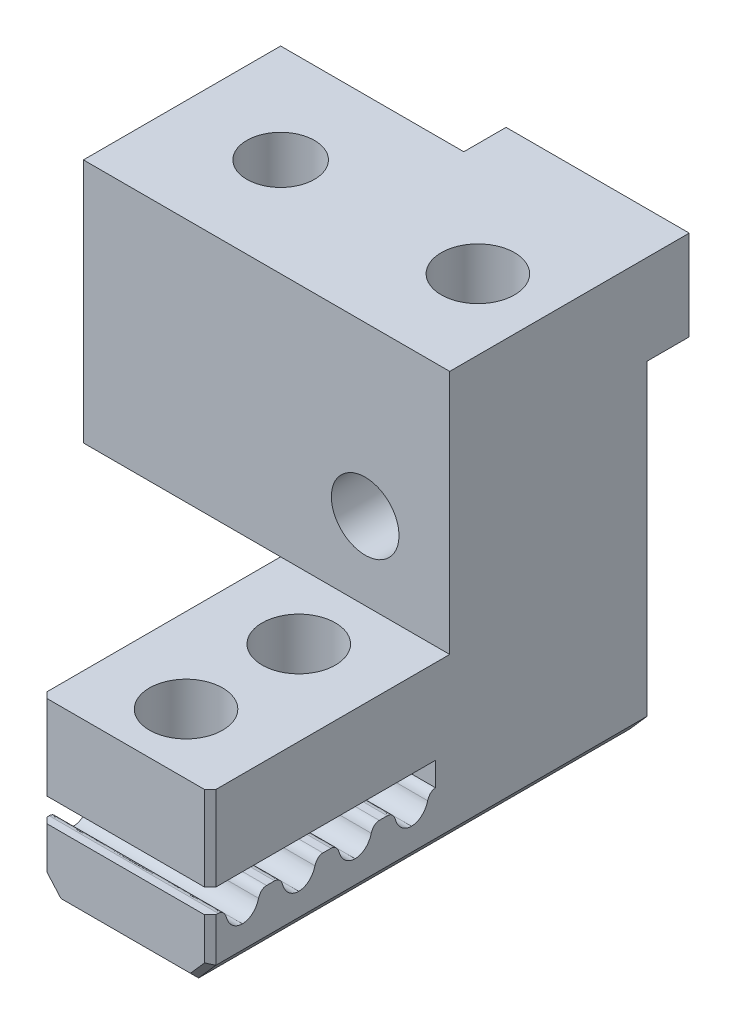
from build123d import *

# Parameters (mm, degrees)
BOSS_EXTRUDE1_DEPTH     = 13
SKETCH6_W               = 6
SKETCH6_H               = 5
BOSS_EXTRUDE4_DEPTH     = 5.6
SKETCH16_W              = 6
SKETCH16_H              = 8
BOSS_EXTRUDE5_DEPTH     = 0.1
CUT_EXTRUDE6_DEPTH      = 4
CUT_EXTRUDE6_DEPTH_BACK = 3.6
SKETCH15_R              = 1.3
CUT_EXTRUDE7_DEPTH      = 8.7202
CUT_EXTRUDE8_START      = -0.2202
SKETCH19_W              = 6
SKETCH19_H              = 8
SKETCH19_R              = 1.3
CUT_EXTRUDE8_DEPTH      = 0.2202
SKETCH12_R              = 1.2
CUT_EXTRUDE5_DEPTH      = 6
CHAMFER1_SIZE           = 0.2
SKETCH21_R              = 1.2
BOSS_EXTRUDE6_DEPTH     = 2.5
SKETCH24_W              = 6
SKETCH24_H              = 5.5
CUT_EXTRUDE10_DEPTH     = 8.5
SKETCH25_W              = 6
SKETCH25_H              = 7
BOSS_EXTRUDE8_DEPTH     = 12.9
SKETCH26_W              = 6
SKETCH26_H              = 7.39
BOSS_EXTRUDE9_DEPTH     = 3
SKETCH30_R              = 1.2
CUT_EXTRUDE13_DEPTH     = 8
SKETCH31_W              = 7
SKETCH31_H              = 9
BOSS_EXTRUDE11_DEPTH    = 1
SKETCH32_W              = 7
SKETCH32_H              = 9
BOSS_EXTRUDE12_DEPTH    = 1
BOSS_EXTRUDE13_DEPTH    = 1
BOSS_EXTRUDE14_DEPTH    = 1
SKETCH35_W              = 10
SKETCH35_H              = 4.2
CUT_EXTRUDE14_DEPTH     = 10
BOSS_EXTRUDE15_DEPTH    = 6
SKETCH38_R              = 1.3
CUT_EXTRUDE15_DEPTH     = 4
SKETCH39_R              = 1.2
CUT_EXTRUDE16_DEPTH     = 10
SKETCH40_W              = 14
SKETCH40_H              = 1.5
CUT_EXTRUDE17_DEPTH     = 10
SKETCH41_W              = 6.5
SKETCH41_H              = 3.19
CUT_EXTRUDE18_DEPTH     = 1.5
CROQUIS3_W              = 8.5
CROQUIS3_H              = 8.726674232
CORTAR_EXTRUIR3_DEPTH   = 1


with BuildPart() as part:
    # Sketch1 → Boss-Extrude1 (new body)
    with BuildSketch(Plane.XY):
        Polygon((3, 3.05), (3, -2.253801214), (2.388188946, -2.95), (-2.388188946, -2.95), (-3, -2.253801214), (-3, 3.05), align=None)
    extrude(amount=BOSS_EXTRUDE1_DEPTH)

    # Sketch6 → Boss-Extrude4 (add)
    with BuildSketch(Plane(origin=(0, 3.05, 0), x_dir=(1, 0, 0), z_dir=(0, 1, 0))):
        with Locations((0, -2.5)):
            Rectangle(SKETCH6_W, SKETCH6_H)
    extrude(amount=BOSS_EXTRUDE4_DEPTH)

    # Sketch16 → Boss-Extrude5 (add)
    with BuildSketch(Plane(origin=(0, 3.05, 0), x_dir=(1, 0, 0), z_dir=(0, 1, 0))):
        with Locations((0, -9)):
            Rectangle(SKETCH16_W, SKETCH16_H)
    extrude(amount=BOSS_EXTRUDE5_DEPTH)

    # Sketch18 → Cut-Extrude6 (cut, two sides: drawn at the far end of the back side and taken through both)
    with BuildSketch(Plane(origin=(0, 0, 0), x_dir=(0, 0, -1), z_dir=(1, 0, 0)).offset(-CUT_EXTRUDE6_DEPTH_BACK)):
        with BuildLine():
            Line((-8.8572, -0.0702), (-12.8572, -0.0702))
            Line((-12.8572, -0.0702), (-13, -0.0702))
            Line((-13, -0.0702), (-13, -0.7))
            Line((-13, -0.7), (-12.8572, -0.7))
            Line((-12.8572, -0.7), (-12.7144, -0.7))
            add(Edge.make_bspline(
                [(-12.7144, -0.7), (-12.5198, -0.7), (-12.43, -0.9509)],
                knots=[0.103448276, 0.103448276, 0.103448276, 0.137931034, 0.137931034, 0.137931034], degree=2))
            add(Edge.make_bspline(
                [(-12.43, -0.9509), (-12.3594, -1.2388), (-12.13, -1.45), (-11.8572, -1.45)],
                knots=[0.137931034, 0.137931034, 0.137931034, 0.137931034, 0.172413793, 0.172413793, 0.172413793, 0.172413793], degree=3))
            add(Edge.make_bspline(
                [(-11.8572, -1.45), (-11.5844, -1.45), (-11.355, -1.2388), (-11.2844, -0.9509)],
                knots=[0.172413793, 0.172413793, 0.172413793, 0.172413793, 0.206896552, 0.206896552, 0.206896552, 0.206896552], degree=3))
            add(Edge.make_bspline(
                [(-11.2844, -0.9509), (-11.1946, -0.7), (-11, -0.7)],
                knots=[0.206896552, 0.206896552, 0.206896552, 0.24137931, 0.24137931, 0.24137931], degree=2))
            Line((-11, -0.7), (-10.8572, -0.7))
            Line((-10.8572, -0.7), (-10.7144, -0.7))
            add(Edge.make_bspline(
                [(-10.7144, -0.7), (-10.5198, -0.7), (-10.43, -0.9509)],
                knots=[0.310344828, 0.310344828, 0.310344828, 0.344827586, 0.344827586, 0.344827586], degree=2))
            add(Edge.make_bspline(
                [(-10.43, -0.9509), (-10.3594, -1.2388), (-10.13, -1.45), (-9.8572, -1.45)],
                knots=[0.344827586, 0.344827586, 0.344827586, 0.344827586, 0.379310345, 0.379310345, 0.379310345, 0.379310345], degree=3))
            add(Edge.make_bspline(
                [(-9.8572, -1.45), (-9.5844, -1.45), (-9.355, -1.2388), (-9.2844, -0.9509)],
                knots=[0.379310345, 0.379310345, 0.379310345, 0.379310345, 0.413793103, 0.413793103, 0.413793103, 0.413793103], degree=3))
            add(Edge.make_bspline(
                [(-9.2844, -0.9509), (-9.1946, -0.7), (-9, -0.7)],
                knots=[0.413793103, 0.413793103, 0.413793103, 0.448275862, 0.448275862, 0.448275862], degree=2))
            Line((-9, -0.7), (-8.8572, -0.7))
            Line((-8.8572, -0.7), (-8.7144, -0.7))
            add(Edge.make_bspline(
                [(-8.7144, -0.7), (-8.5198, -0.7), (-8.43, -0.9509)],
                knots=[0.517241379, 0.517241379, 0.517241379, 0.551724138, 0.551724138, 0.551724138], degree=2))
            add(Edge.make_bspline(
                [(-8.43, -0.9509), (-8.3594, -1.2388), (-8.13, -1.45), (-7.8572, -1.45)],
                knots=[0.551724138, 0.551724138, 0.551724138, 0.551724138, 0.586206897, 0.586206897, 0.586206897, 0.586206897], degree=3))
            add(Edge.make_bspline(
                [(-7.8572, -1.45), (-7.5844, -1.45), (-7.355, -1.2388), (-7.2844, -0.9509)],
                knots=[0.586206897, 0.586206897, 0.586206897, 0.586206897, 0.620689655, 0.620689655, 0.620689655, 0.620689655], degree=3))
            add(Edge.make_bspline(
                [(-7.2844, -0.9509), (-7.1946, -0.7), (-7, -0.7)],
                knots=[0.620689655, 0.620689655, 0.620689655, 0.655172414, 0.655172414, 0.655172414], degree=2))
            Line((-7, -0.7), (-6.8572, -0.7))
            Line((-6.8572, -0.7), (-6.7144, -0.7))
            add(Edge.make_bspline(
                [(-6.7144, -0.7), (-6.5198, -0.7), (-6.43, -0.9509)],
                knots=[0.724137931, 0.724137931, 0.724137931, 0.75862069, 0.75862069, 0.75862069], degree=2))
            add(Edge.make_bspline(
                [(-6.43, -0.9509), (-6.3594, -1.2388), (-6.13, -1.45), (-5.8572, -1.45)],
                knots=[0.75862069, 0.75862069, 0.75862069, 0.75862069, 0.793103448, 0.793103448, 0.793103448, 0.793103448], degree=3))
            add(Edge.make_bspline(
                [(-5.8572, -1.45), (-5.5844, -1.45), (-5.355, -1.2388), (-5.2844, -0.9509)],
                knots=[0.793103448, 0.793103448, 0.793103448, 0.793103448, 0.827586207, 0.827586207, 0.827586207, 0.827586207], degree=3))
            add(Edge.make_bspline(
                [(-5.2844, -0.9509), (-5.1946, -0.7), (-5, -0.7)],
                knots=[0.827586207, 0.827586207, 0.827586207, 0.862068966, 0.862068966, 0.862068966], degree=2))
            Line((-5, -0.7), (-5, -0.0702))
            Line((-5, -0.0702), (-8.8572, -0.0702))
        make_face()
    extrude(amount=CUT_EXTRUDE6_DEPTH + CUT_EXTRUDE6_DEPTH_BACK, mode=Mode.SUBTRACT)

    # Sketch15 → Cut-Extrude7 (cut)
    with BuildSketch(Plane(origin=(0, 8.65, 0), x_dir=(1, 0, 0), z_dir=(0, 1, 0))):
        with Locations(Location((0, -10.8572, 0), (0, 0, 180))):
            Circle(SKETCH15_R)
        with Locations(Location((0, -6.8572, 0), (0, 0, 180))):
            Circle(SKETCH15_R)
    extrude(amount=-CUT_EXTRUDE7_DEPTH, mode=Mode.SUBTRACT)

    # Sketch19 → Cut-Extrude8 (cut)
    with BuildSketch(Plane.XZ.offset(0.0702).offset(CUT_EXTRUDE8_START)):
        with Locations((0, 9)):
            Rectangle(SKETCH19_W, SKETCH19_H)
        with Locations(Location((0, 10.8572, 0), (0, 0, 180))):
            Circle(SKETCH19_R, mode=Mode.SUBTRACT)
        with Locations(Location((0, 6.8572, 0), (0, 0, 180))):
            Circle(SKETCH19_R, mode=Mode.SUBTRACT)
    extrude(amount=CUT_EXTRUDE8_DEPTH, mode=Mode.SUBTRACT)

    # Sketch12 → Cut-Extrude5 (cut)
    with BuildSketch(Plane.XY.offset(5)):
        with Locations((0, 5.85)):
            Circle(SKETCH12_R)
    extrude(amount=-CUT_EXTRUDE5_DEPTH, mode=Mode.SUBTRACT)

    # Chamfer1
    chamfer1_edges = [part.edges().sort_by_distance(p)[0] for p in [
        (-2.694094473, -2.601900607, 13),
        (0, -2.95, 13),
        (2.694094473, -2.601900607, 13),
        (3, 1.65, 13),
        (3, -1.476900607, 13),
        (-3, -1.476900607, 13),
        (-3, 1.65, 13),
    ]]
    chamfer(chamfer1_edges, length=CHAMFER1_SIZE)

    # Sketch21 → Boss-Extrude6 (add)
    with BuildSketch(Plane(origin=(0, 0, 0), x_dir=(-1, 0, 0), z_dir=(0, 0, -1))):
        Polygon((-2.388188946, -2.95), (2.388188946, -2.95), (3, -2.253801214), (3, 8.65), (-3, 8.65), (-3, -2.253801214), align=None)
        with Locations(Location((0, 5.85, 0), (0, 0, 180))):
            Circle(SKETCH21_R, mode=Mode.SUBTRACT)
    extrude(amount=BOSS_EXTRUDE6_DEPTH)

    # Sketch24 → Cut-Extrude10 (cut)
    with BuildSketch(Plane.XY.offset(5)):
        with Locations((0, 5.9)):
            Rectangle(SKETCH24_W, SKETCH24_H)
    extrude(amount=-CUT_EXTRUDE10_DEPTH, mode=Mode.SUBTRACT)

    # Sketch25 → Boss-Extrude8 (add)
    with BuildSketch(Plane(origin=(0, 3.15, 0), x_dir=(1, 0, 0), z_dir=(0, 1, 0))):
        with Locations((0, -1)):
            Rectangle(SKETCH25_W, SKETCH25_H)
    extrude(amount=BOSS_EXTRUDE8_DEPTH)

    # Sketch26 → Boss-Extrude9 (add)
    with BuildSketch(Plane(origin=(0, 0, -2.5), x_dir=(-1, 0, 0), z_dir=(0, 0, -1))):
        with Locations((0, 12.355)):
            Rectangle(SKETCH26_W, SKETCH26_H)
    extrude(amount=BOSS_EXTRUDE9_DEPTH)

    # Sketch30 → Cut-Extrude13 (cut)
    with BuildSketch(Plane(origin=(0, 0, -2.5), x_dir=(-1, 0, 0), z_dir=(0, 0, -1))):
        with Locations((0, 5.9)):
            Circle(SKETCH30_R)
    extrude(amount=-CUT_EXTRUDE13_DEPTH, mode=Mode.SUBTRACT)

    # Sketch31 → Boss-Extrude11 (add)
    with BuildSketch(Plane(origin=(3, 0, 0), x_dir=(0, 0, -1), z_dir=(1, 0, 0))):
        with Locations((-1, 7.65)):
            Rectangle(SKETCH31_W, SKETCH31_H)
    extrude(amount=BOSS_EXTRUDE11_DEPTH)

    # Sketch32 → Boss-Extrude12 (add)
    with BuildSketch(Plane.ZY.offset(3)):
        with Locations((1, 7.65)):
            Rectangle(SKETCH32_W, SKETCH32_H)
    extrude(amount=BOSS_EXTRUDE12_DEPTH)

    # Sketch33 → Boss-Extrude13 (add)
    with BuildSketch(Plane(origin=(3, 0, 0), x_dir=(0, 0, -1), z_dir=(1, 0, 0))):
        Polygon((2.5, 12.15), (2.5, 8.66), (5.5, 8.66), (5.5, 16.05), (-4.5, 16.05), (-4.5, 12.15), align=None)
    extrude(amount=BOSS_EXTRUDE13_DEPTH)

    # Sketch34 → Boss-Extrude14 (add)
    with BuildSketch(Plane.ZY.offset(3)):
        Polygon((-2.5, 12.15), (4.5, 12.15), (4.5, 16.05), (-5.5, 16.05), (-5.5, 8.66), (-2.5, 8.66), align=None)
    extrude(amount=BOSS_EXTRUDE14_DEPTH)

    # Sketch35 → Cut-Extrude14 (cut)
    with BuildSketch(Plane.ZY.offset(4)):
        with Locations((-0.5, 13.95)):
            Rectangle(SKETCH35_W, SKETCH35_H)
    extrude(amount=-CUT_EXTRUDE14_DEPTH, mode=Mode.SUBTRACT)

    # Sketch36 → Boss-Extrude15 (add)
    with BuildSketch(Plane.ZY.offset(4)):
        Polygon((4.5, 3.15), (4.5, 11.85), (-5.5, 11.85), (-5.5, 8.66), (-2.5, 8.66), (-2.5, 3.15), align=None)
    extrude(amount=BOSS_EXTRUDE15_DEPTH)

    # Sketch38 → Cut-Extrude15 (cut)
    with BuildSketch(Plane(origin=(0, 11.85, 0), x_dir=(1, 0, 0), z_dir=(0, 1, 0))):
        with Locations(Location((0.5, -1, 0), (0, 0, 270))):
            Circle(SKETCH38_R)
    extrude(amount=-CUT_EXTRUDE15_DEPTH, mode=Mode.SUBTRACT)

    # Sketch39 → Cut-Extrude16 (cut)
    with BuildSketch(Plane(origin=(0, 11.85, 0), x_dir=(1, 0, 0), z_dir=(0, 1, 0))):
        with Locations(Location((-6.5, -1, 0), (0, 0, 270))):
            Circle(SKETCH39_R)
    extrude(amount=-CUT_EXTRUDE16_DEPTH, mode=Mode.SUBTRACT)

    # Sketch40 → Cut-Extrude17 (cut)
    with BuildSketch(Plane(origin=(0, 11.85, 0), x_dir=(1, 0, 0), z_dir=(0, 1, 0))):
        with Locations((-3, 4.75)):
            Rectangle(SKETCH40_W, SKETCH40_H)
    extrude(amount=-CUT_EXTRUDE17_DEPTH, mode=Mode.SUBTRACT)

    # Sketch41 → Cut-Extrude18 (cut)
    with BuildSketch(Plane(origin=(0, 0, -4), x_dir=(-1, 0, 0), z_dir=(0, 0, -1))):
        with Locations((6.75, 10.255)):
            Rectangle(SKETCH41_W, SKETCH41_H)
    extrude(amount=-CUT_EXTRUDE18_DEPTH, mode=Mode.SUBTRACT)

    # Croquis3 → Cortar-Extruir3 (cut)
    with BuildSketch(Plane(origin=(4, 0, 0), x_dir=(0, 0, -1), z_dir=(1, 0, 0))):
        with Locations((-0.25, 7.486662884)):
            Rectangle(CROQUIS3_W, CROQUIS3_H)
    extrude(amount=-CORTAR_EXTRUIR3_DEPTH, mode=Mode.SUBTRACT)


solid = part.part
